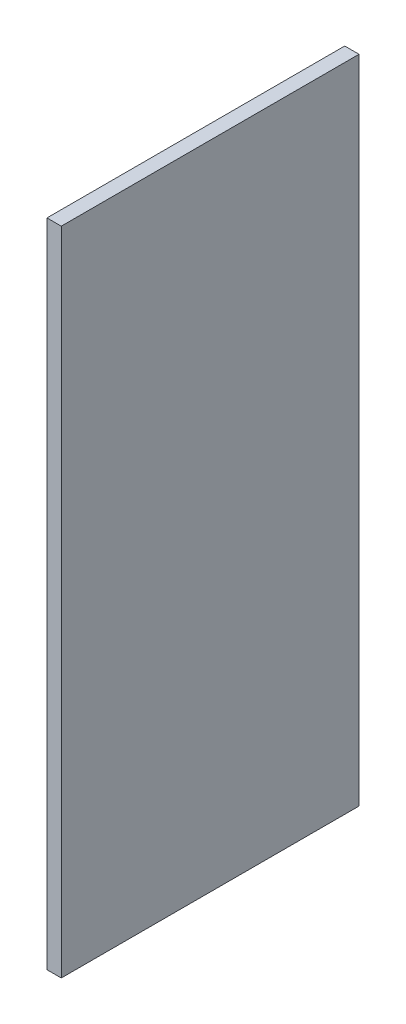
from build123d import *

# Parameters (mm, degrees)
SKPAREDGRANDEOESTE_W   = 18
SKPAREDGRANDEOESTE_H   = 375
PAREDGRANDEOESTE_DEPTH = 820


with BuildPart() as part:
    # SkParedGrandeOeste → ParedGrandeOeste (new body)
    with BuildSketch(Plane(origin=(0, 50, 0), x_dir=(1, 0, 0), z_dir=(0, 1, 0))):
        with Locations((-194, 0)):
            Rectangle(SKPAREDGRANDEOESTE_W, SKPAREDGRANDEOESTE_H)
    extrude(amount=PAREDGRANDEOESTE_DEPTH)


solid = part.part
